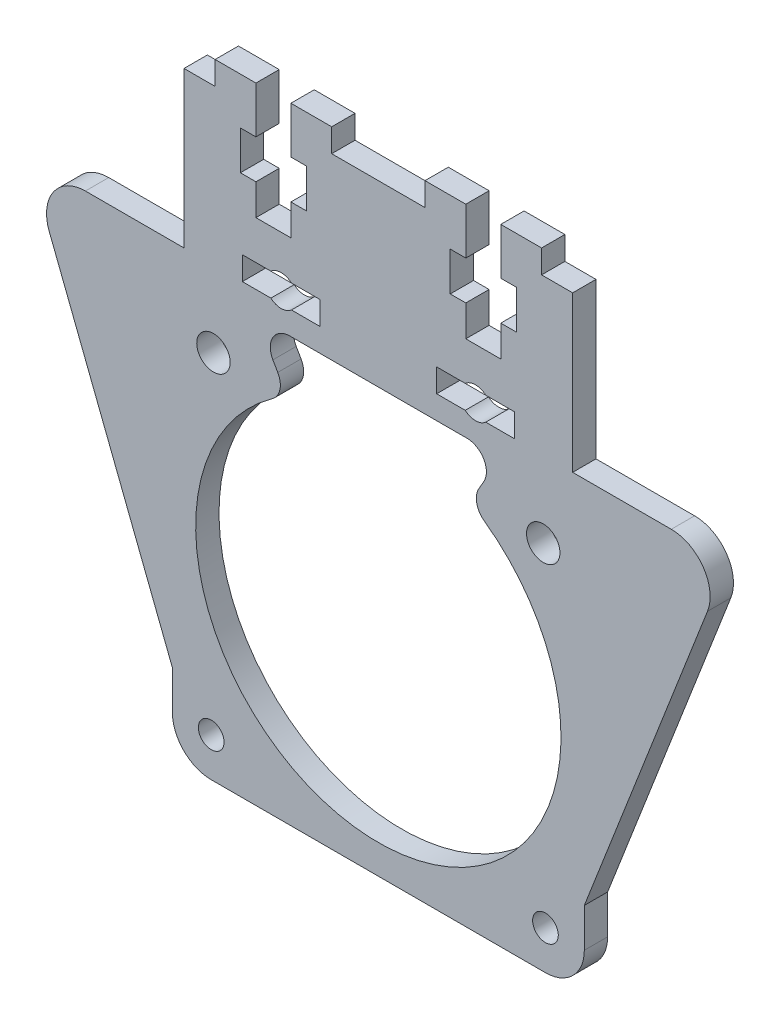
from build123d import *

# Parameters (mm, degrees)
SKETCH_1_W           = 53
SKETCH_1_H           = 54.5
SKETCH_1_R           = 23.5
EXTRUDE_1_DEPTH      = 1.5
SKETCH_2_R           = 1.65
SKETCH_2_R_2         = 2.15
CUT_EXTRUDE_1_DEPTH  = 3
FILLET_1_R           = 5
CUT_EXTRUDE_2_DEPTH  = 5
SKETCH_4_W           = 53
SKETCH_4_H           = 3
EXTRUDE_2_DEPTH      = 3
FILLET_2_R           = 2.5
SKETCH_5_W           = 50
SKETCH_5_H           = 20
EXTRUDE_3_DEPTH      = 3
CUT_EXTRUDE_9_DEPTH  = 3
FILLET_3_R           = 5
SKETCH_8_W           = 15
SKETCH_8_H           = 3
EXTRUDE_4_DEPTH      = 3
CUT_EXTRUDE_10_DEPTH = 3


with BuildPart() as part:
    # 草图1 → 凸台-拉伸1 (new, symmetric)
    with BuildSketch(Plane.XY):
        Rectangle(SKETCH_1_W, SKETCH_1_H)
        Circle(SKETCH_1_R, mode=Mode.SUBTRACT)
    extrude(amount=EXTRUDE_1_DEPTH, both=True)

    # 草图2 → 切除-拉伸1 (cut)
    with BuildSketch(Plane(origin=(0, 0, -1.5), x_dir=(-1, 0, 0), z_dir=(0, 0, -1))):
        with Locations((-21.5, -22.25)):
            Circle(SKETCH_2_R)
        with Locations((-21.213203436, 20.463203436)):
            Circle(SKETCH_2_R_2)
        with Locations((21.5, -22.25)):
            Circle(SKETCH_2_R)
        with Locations((21.213203436, 20.463203436)):
            Circle(SKETCH_2_R_2)
    extrude(amount=-CUT_EXTRUDE_1_DEPTH, mode=Mode.SUBTRACT)

    # 圆角1
    fillet_1_edges = [part.edges().sort_by_distance(p)[0] for p in [
        (26.5, -27.25, 0),
        (-26.5, -27.25, 0),
    ]]
    fillet(fillet_1_edges, radius=FILLET_1_R)

    # 草图3 → 切除-拉伸2 (cut)
    with BuildSketch(Plane.XY.offset(1.5)):
        Polygon((0, 0), (15.732794835, 27.25), (-15.732794835, 27.25), align=None)
    extrude(amount=-CUT_EXTRUDE_2_DEPTH, mode=Mode.SUBTRACT)

    # 草图4 → 凸台-拉伸2 (add)
    with BuildSketch(Plane(origin=(0, 27.25, 0), x_dir=(1, 0, 0), z_dir=(0, 1, 0))):
        Rectangle(SKETCH_4_W, SKETCH_4_H)
    extrude(amount=EXTRUDE_2_DEPTH)

    # 圆角2
    fillet_2_edges = [part.edges().sort_by_distance(p)[0] for p in [
        (11.75, 20.351596989, 0),
        (-11.75, 20.351596989, 0),
        (-15.732794835, 27.25, 0),
        (15.732794835, 27.25, 0),
    ]]
    fillet(fillet_2_edges, radius=FILLET_2_R)

    # 草图5 → 凸台-拉伸3 (add)
    with BuildSketch(Plane.XY.offset(1.5)):
        Polygon((-26.5, -17.25), (-45, 30.25), (-26.5, 30.25), align=None)
        Polygon((26.5, -17.25), (45, 30.25), (26.5, 30.25), align=None)
        with Locations((0, 40.25)):
            Rectangle(SKETCH_5_W, SKETCH_5_H)
    extrude(amount=-EXTRUDE_3_DEPTH)

    # 草图6 → 切除-拉伸9 (cut)
    with BuildSketch(Plane.XY.offset(1.5)):
        with BuildLine():
            Line((-11.177124344, 33.25), (-7.5, 33.25))
            Line((-7.5, 33.25), (-7.5, 30.25))
            Line((-7.5, 30.25), (-11.177124344, 30.25))
            ThreePointArc((-11.177124344, 30.25), (-12.5, 29.75), (-13.822875656, 30.25))
            Line((-13.822875656, 30.25), (-17.5, 30.25))
            Line((-17.5, 30.25), (-17.5, 33.25))
            Line((-17.5, 33.25), (-13.822875656, 33.25))
            ThreePointArc((-13.822875656, 33.25), (-12.5, 33.75), (-11.177124344, 33.25))
        make_face()
        with BuildLine():
            Line((13.822875656, 33.25), (17.5, 33.25))
            Line((17.5, 33.25), (17.5, 30.25))
            Line((17.5, 30.25), (13.822875656, 30.25))
            ThreePointArc((13.822875656, 30.25), (12.5, 29.75), (11.177124344, 30.25))
            Line((11.177124344, 30.25), (7.5, 30.25))
            Line((7.5, 30.25), (7.5, 33.25))
            Line((7.5, 33.25), (11.177124344, 33.25))
            ThreePointArc((11.177124344, 33.25), (12.5, 33.75), (13.822875656, 33.25))
        make_face()
    extrude(amount=-CUT_EXTRUDE_9_DEPTH, mode=Mode.SUBTRACT)

    # 圆角3
    fillet_3_edges = [part.edges().sort_by_distance(p)[0] for p in [
        (-45, 30.25, 0),
        (45, 30.25, 0),
    ]]
    fillet(fillet_3_edges, radius=FILLET_3_R)

    # 草图8 → 凸台-拉伸4 (add)
    with BuildSketch(Plane.XY.offset(1.5)):
        with Locations((-13.5, 51.75)):
            Rectangle(SKETCH_8_W, SKETCH_8_H)
        with Locations((13.5, 51.75)):
            Rectangle(SKETCH_8_W, SKETCH_8_H)
    extrude(amount=-EXTRUDE_4_DEPTH)

    # 草图9 → 切除-拉伸10 (cut)
    with BuildSketch(Plane.XY.offset(1.5)):
        Polygon((-15.75, 53.25), (-15.75, 47.25), (-17.75, 47.25), (-17.75, 42.25), (-15.75, 42.25), (-15.75, 38.25), (-11.25, 38.25), (-11.25, 42.25), (-9.25, 42.25), (-9.25, 47.25), (-11.25, 47.25), (-11.25, 53.25), align=None)
        Polygon((11.25, 47.25), (11.25, 53.25), (15.75, 53.25), (15.75, 47.25), (17.75, 47.25), (17.75, 42.25), (15.75, 42.25), (15.75, 38.25), (11.25, 38.25), (11.25, 42.25), (9.25, 42.25), (9.25, 47.25), align=None)
    extrude(amount=-CUT_EXTRUDE_10_DEPTH, mode=Mode.SUBTRACT)


solid = part.part
